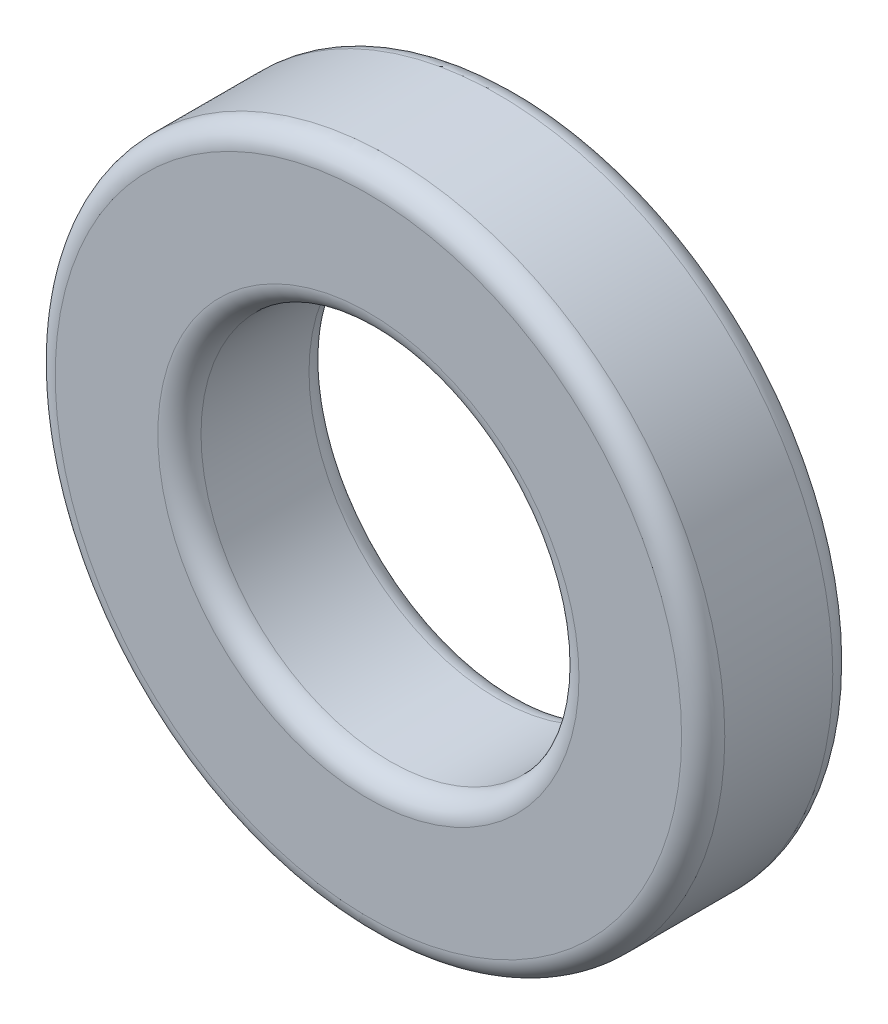
from build123d import *

# Parameters (mm, degrees)
SKETCH_1_R      = 31
SKETCH_1_R_2    = 17.5
EXTRUDE_1_DEPTH = 14
FILLET_2_R      = 2


with BuildPart() as part:
    # 草图1 → 凸台-拉伸1 (new body)
    with BuildSketch(Plane.XY):
        Circle(SKETCH_1_R)
        Circle(SKETCH_1_R_2, mode=Mode.SUBTRACT)
    extrude(amount=EXTRUDE_1_DEPTH)

    # 圆角2
    fillet_2_edges = [part.edges().sort_by_distance(p)[0] for p in [
        (-31, 0, 0),
        (-31, 0, 14),
        (-17.5, 0, 0),
        (-17.5, 0, 14),
    ]]
    fillet(fillet_2_edges, radius=FILLET_2_R)


solid = part.part
